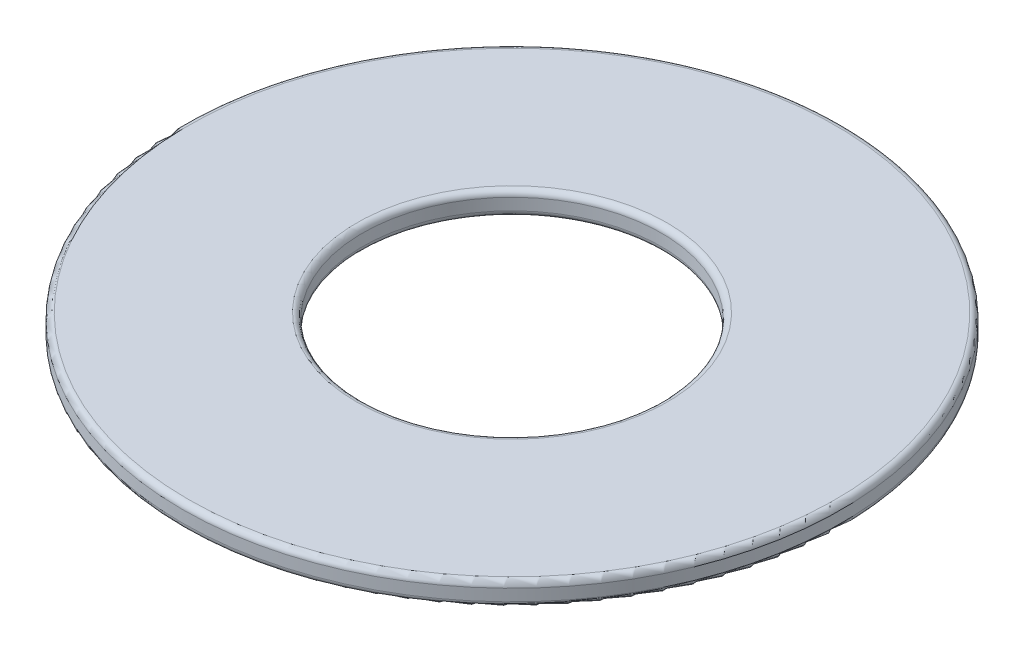
from build123d import *

# Parameters (mm, degrees)
SKETCH1_R           = 7.14375
SKETCH1_R_2         = 3.2385
BOSS_EXTRUDE1_DEPTH = 0.508
FILLET1_R           = 0.127


with BuildPart() as part:
    # Sketch1 → Boss-Extrude1 (new body)
    with BuildSketch(Plane(origin=(0, 0, 0), x_dir=(1, 0, 0), z_dir=(0, 1, 0))):
        with Locations(Location((0, 0, 0), (0, 0, 270))):
            Circle(SKETCH1_R)
        with Locations(Location((0, 0, 0), (0, 0, 270))):
            Circle(SKETCH1_R_2, mode=Mode.SUBTRACT)
    extrude(amount=BOSS_EXTRUDE1_DEPTH)

    # Fillet1
    fillet1_edges = [part.edges().sort_by_distance(p)[0] for p in [
        (0, 0, -7.14375),
        (0, 0.508, -7.14375),
        (0, 0, -3.2385),
        (0, 0.508, -3.2385),
    ]]
    fillet(fillet1_edges, radius=FILLET1_R)


solid = part.part
